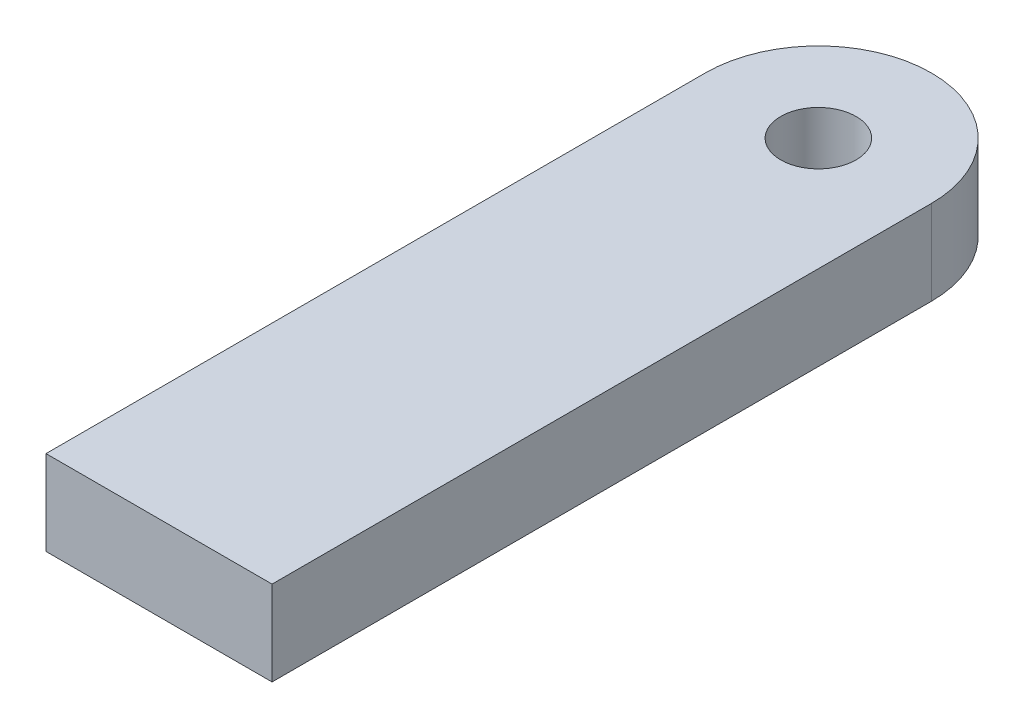
from build123d import *

# Parameters (mm, degrees)
ESQUISSE1_R        = 4
BOSS_EXTRU_1_DEPTH = 9


with BuildPart() as part:
    # Esquisse1 → Boss.-Extru.1 (new body)
    with BuildSketch(Plane(origin=(0, 0, 0), x_dir=(1, 0, 0), z_dir=(0, 1, 0))):
        with BuildLine():
            Line((-12, -35), (12, -35))
            Line((12, -35), (12, 35))
            ThreePointArc((12, 35), (0, 47), (-12, 35))
            Line((-12, 35), (-12, -35))
        make_face()
        with Locations(Location((0, 35, 0), (0, 0, 270))):
            Circle(ESQUISSE1_R, mode=Mode.SUBTRACT)
    extrude(amount=BOSS_EXTRU_1_DEPTH)


solid = part.part
